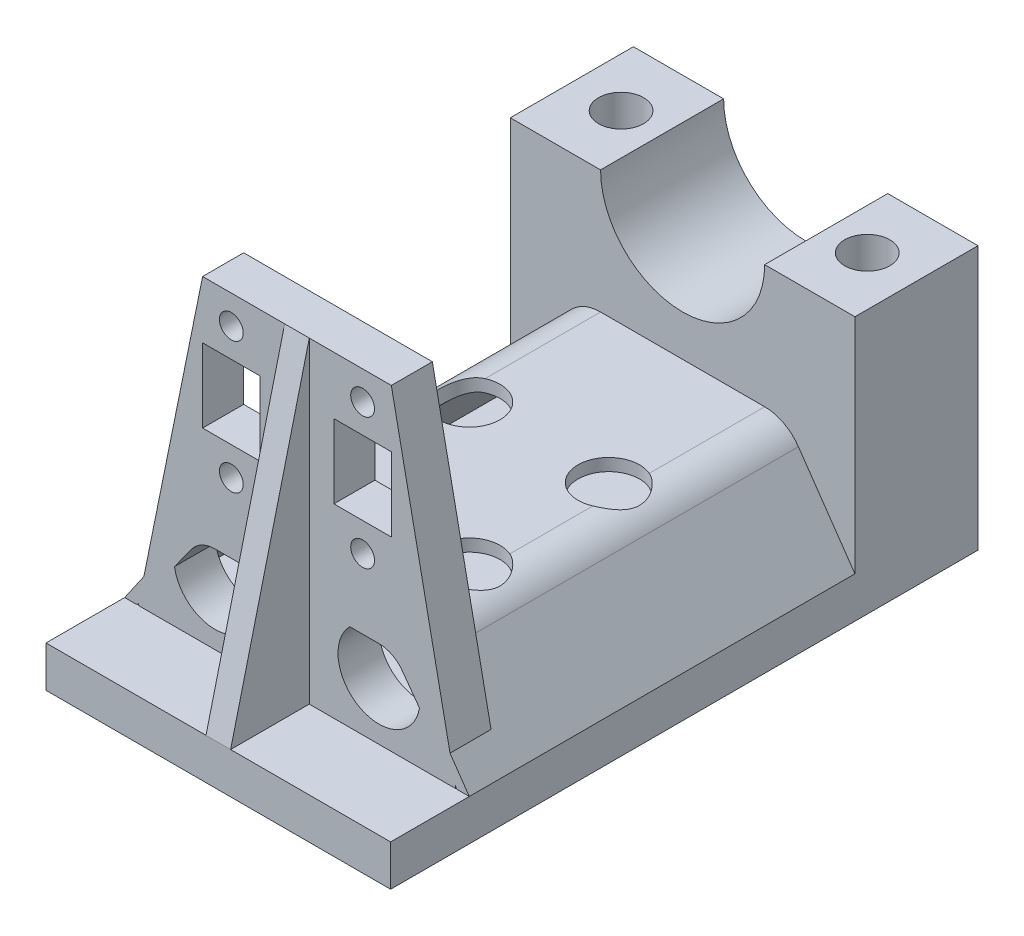
from build123d import *

# Parameters (mm, degrees)
MOTOR_MOUNT_SOLID_DEPTH                   = 7.5
ENCODER_DISTANCE_SKETCH_W                 = 50
ENCODER_DISTANCE_SKETCH_H                 = 57
ENCODER_DISTANCE_SOLID_DEPTH              = 5
ENCODER_MOUNT_SKETCH_R                    = 1.45
ENCODER_MOUNT_SKETCH_W                    = 7
ENCODER_MOUNT_SKETCH_H                    = 9
ENCODER_MOUNT_SOLID_DEPTH                 = 5
MOTOR_CLAMP_MOUNTING_HOLES_CUT_DEPTH      = 85.824819481
MOTOR_CLAMP_MOUNTING_HOLES_CUT_DEPTH_BACK = 85.824819481
MOTOR_CLAMP_MOUNTING_HOLES_SKETCH_R       = 2.75
GUSSET_PLATE_SKETCH_W                     = 50
GUSSET_PLATE_SKETCH_H                     = 5
GUSSET_PLATE_SOLID_DEPTH                  = 16.5
GUSSET_SOLID_DEPTH                        = 1.5
MOUNTING_PLATE_SKETCH_W                   = 50
MOUNTING_PLATE_SKETCH_H                   = 92
MOUNTING_PLATE_SKETCH_R                   = 2.65
MOUNTING_PLATE_SOLID_DEPTH                = 5
MOUNTING_HOLES_CUT_DEPTH                  = 101.440280764
MOUNTING_HOLES_CUT_DEPTH_BACK             = 101.440280764
MOUNTING_HOLE_SKETCH_R                    = 2.65
MOUNTING_PLATE_TRIM_SKETCH_W              = 50
MOUNTING_PLATE_TRIM_SKETCH_H              = 13.5
MOUNTING_PLATE_TRIM_SKETCH_H_2            = 42
MOUNTING_PLATE_TRIM_SKETCH_W_2            = 23.5
MOUNTING_PLATE_TRIM_SKETCH_H_3            = 16.5
MOUNTING_PLATE_TRIM_CUT_DEPTH             = 2
CUT_EXTRUDE1_DEPTH                        = 102.917859083
CUT_EXTRUDE1_DEPTH_BACK                   = 102.917859083
SKETCH2_W                                 = 50
SKETCH2_H                                 = 120
SKETCH2_W_2                               = 42
SKETCH2_H_2                               = 54.272597004
SKETCH3_W                                 = 42
SKETCH3_H                                 = 71.586450004
BOSS_EXTRUDE1_DEPTH                       = 5
CUT_EXTRUDE2_DEPTH                        = 78.722819275
CUT_EXTRUDE2_DEPTH_BACK                   = 78.722819275
SKETCH4_R                                 = 2.15
CUT_EXTRUDE3_DEPTH                        = 73.922847458
CUT_EXTRUDE3_DEPTH_BACK                   = 73.922847458
SKETCH5_R                                 = 5
BOSS_EXTRUDE4_REACH                       = 83.23
CUT_EXTRUDE5_REACH                        = 82.326
SKETCH7_R                                 = 3.75


with BuildPart() as part:
    # Mouting Mount Sketch → Motor Mount Solid (new, symmetric)
    with BuildSketch(Plane.XY):
        with BuildLine():
            Line((-25, -55), (25, -55))
            Line((25, -55), (25, 0))
            Line((25, 0), (10, 0))
            ThreePointArc((10, 0), (0, -10), (-10, 0))
            Line((-10, 0), (-25, 0))
            Line((-25, 0), (-25, -55))
        make_face()
    extrude(amount=MOTOR_MOUNT_SOLID_DEPTH, both=True)

    # Encoder Distance Sketch → Encoder Distance Solid (add)
    with BuildSketch(Plane.XZ.offset(55)):
        with Locations((0, 21)):
            Rectangle(ENCODER_DISTANCE_SKETCH_W, ENCODER_DISTANCE_SKETCH_H)
    extrude(amount=ENCODER_DISTANCE_SOLID_DEPTH)

    # Encoder Mount Sketch → Encoder Mount Solid (add)
    with BuildSketch(Plane.XY.offset(49.5)):
        Polygon((-25, -60), (-25, -55), (-11.5, 11.5), (11.5, 11.5), (25, -55), (25, -60), align=None)
        with Locations((-8, 8)):
            Circle(ENCODER_MOUNT_SKETCH_R, mode=Mode.SUBTRACT)
        with Locations((8, 8)):
            Circle(ENCODER_MOUNT_SKETCH_R, mode=Mode.SUBTRACT)
        with Locations((-8, -8)):
            Circle(ENCODER_MOUNT_SKETCH_R, mode=Mode.SUBTRACT)
        with Locations((8, -8)):
            Circle(ENCODER_MOUNT_SKETCH_R, mode=Mode.SUBTRACT)
        with Locations((-8, 0)):
            Rectangle(ENCODER_MOUNT_SKETCH_W, ENCODER_MOUNT_SKETCH_H, mode=Mode.SUBTRACT)
        with Locations((8, 0)):
            Rectangle(ENCODER_MOUNT_SKETCH_W, ENCODER_MOUNT_SKETCH_H, mode=Mode.SUBTRACT)
    extrude(amount=ENCODER_MOUNT_SOLID_DEPTH)

    # Motor Clamp Mounting Holes Sketch → Motor Clamp Mounting Holes Cut (cut, two sides: drawn at the far end of the back side and taken through both)
    with BuildSketch(Plane(origin=(0, 0, 0), x_dir=(1, 0, 0), z_dir=(0, 1, 0)).offset(-MOTOR_CLAMP_MOUNTING_HOLES_CUT_DEPTH_BACK)):
        with Locations(Location((-15, 0, 0), (0, 0, 180))):
            Circle(MOTOR_CLAMP_MOUNTING_HOLES_SKETCH_R)
        with Locations(Location((15, 0, 0), (0, 0, 180))):
            Circle(MOTOR_CLAMP_MOUNTING_HOLES_SKETCH_R)
    extrude(amount=MOTOR_CLAMP_MOUNTING_HOLES_CUT_DEPTH + MOTOR_CLAMP_MOUNTING_HOLES_CUT_DEPTH_BACK, mode=Mode.SUBTRACT)

    # Gusset Plate Sketch → Gusset Plate Solid (add)
    with BuildSketch(Plane.XY.offset(54.5)):
        with Locations((0, -57.5)):
            Rectangle(GUSSET_PLATE_SKETCH_W, GUSSET_PLATE_SKETCH_H)
    extrude(amount=GUSSET_PLATE_SOLID_DEPTH)

    # Gusset Sketch → Gusset Solid (add, symmetric)
    with BuildSketch(Plane(origin=(0, 0, 0), x_dir=(0, 0, -1), z_dir=(1, 0, 0))):
        Polygon((-54.5, 11.5), (-71, -55), (-54.5, -55), align=None)
    extrude(amount=GUSSET_SOLID_DEPTH, both=True)

    # Mounting Plate Sketch → Mounting Plate Solid (add)
    with BuildSketch(Plane(origin=(0, -55, 0), x_dir=(1, 0, 0), z_dir=(0, 1, 0))):
        with Locations((0, -25)):
            Rectangle(MOUNTING_PLATE_SKETCH_W, MOUNTING_PLATE_SKETCH_H)
        with Locations((-19, -65)):
            Circle(MOUNTING_PLATE_SKETCH_R, mode=Mode.SUBTRACT)
        with Locations((19, -65)):
            Circle(MOUNTING_PLATE_SKETCH_R, mode=Mode.SUBTRACT)
        with Locations(Location((-19, 15, 0), (0, 0, 270))):
            Circle(MOUNTING_PLATE_SKETCH_R, mode=Mode.SUBTRACT)
        with Locations(Location((19, 15, 0), (0, 0, 270))):
            Circle(MOUNTING_PLATE_SKETCH_R, mode=Mode.SUBTRACT)
    extrude(amount=-MOUNTING_PLATE_SOLID_DEPTH)

    # Mounting Hole Sketch → Mounting Holes Cut (cut, two sides: drawn at the far end of the back side and taken through both)
    with BuildSketch(Plane(origin=(0, -55, 0), x_dir=(1, 0, 0), z_dir=(0, 1, 0)).offset(-MOUNTING_HOLES_CUT_DEPTH_BACK)):
        with Locations(Location((-19, 15, 0), (0, 0, 270))):
            Circle(MOUNTING_HOLE_SKETCH_R)
        with Locations(Location((19, 15, 0), (0, 0, 270))):
            Circle(MOUNTING_HOLE_SKETCH_R)
        with Locations(Location((19, -65, 0), (0, 0, 90))):
            Circle(MOUNTING_HOLE_SKETCH_R)
        with Locations(Location((-19, -65, 0), (0, 0, 90))):
            Circle(MOUNTING_HOLE_SKETCH_R)
    extrude(amount=MOUNTING_HOLES_CUT_DEPTH + MOUNTING_HOLES_CUT_DEPTH_BACK, mode=Mode.SUBTRACT)

    # Mounting Plate Trim Sketch → Mounting Plate Trim Cut (cut)
    with BuildSketch(Plane(origin=(0, -55, 0), x_dir=(1, 0, 0), z_dir=(0, 1, 0))):
        with Locations((0, 14.25)):
            Rectangle(MOUNTING_PLATE_TRIM_SKETCH_W, MOUNTING_PLATE_TRIM_SKETCH_H)
        with Locations((0, -28.5)):
            Rectangle(MOUNTING_PLATE_TRIM_SKETCH_W, MOUNTING_PLATE_TRIM_SKETCH_H_2)
        with Locations((13.25, -62.75)):
            Rectangle(MOUNTING_PLATE_TRIM_SKETCH_W_2, MOUNTING_PLATE_TRIM_SKETCH_H_3)
        with Locations((-13.25, -62.75)):
            Rectangle(MOUNTING_PLATE_TRIM_SKETCH_W_2, MOUNTING_PLATE_TRIM_SKETCH_H_3)
    extrude(amount=-MOUNTING_PLATE_TRIM_CUT_DEPTH, mode=Mode.SUBTRACT)

    # Sketch2 → Cut-Extrude1 (cut, two sides: drawn at the far end of the back side and taken through both)
    with BuildSketch(Plane(origin=(0, 0, -7.5), x_dir=(-1, 0, 0), z_dir=(0, 0, -1)).offset(-CUT_EXTRUDE1_DEPTH_BACK)):
        Rectangle(SKETCH2_W, SKETCH2_H)
        Rectangle(SKETCH2_W_2, SKETCH2_H_2, mode=Mode.SUBTRACT)
    extrude(amount=CUT_EXTRUDE1_DEPTH + CUT_EXTRUDE1_DEPTH_BACK, mode=Mode.SUBTRACT)


with BuildPart() as cut_extrude1_piece_1:
    # of the separate pieces the step leaves, piece 1, a body of its own (cut_extrude1_pieces)
    add(part.part.solids().sort_by_distance((21, 0, 7.5))[0])



with BuildPart() as cut_extrude1_piece_2:
    # of the separate pieces the step leaves, piece 2, a body of its own (cut_extrude1_pieces)
    add(part.part.solids().sort_by_distance((-1.5, -27.136298502, 54.5))[0])


with BuildPart() as cut_extrude1_piece_1_1:
    add(cut_extrude1_piece_1.part)

    add(cut_extrude1_piece_2.part)  # Boss-Extrude1 merges Cut-Extrude1 piece 2
    # Sketch3 → Boss-Extrude1 (add)
    with BuildSketch(Plane.XZ.offset(27.136298502)):
        with Locations((0, 28.293225002)):
            Rectangle(SKETCH3_W, SKETCH3_H)
    extrude(amount=BOSS_EXTRUDE1_DEPTH)

    # Sketch4 → Cut-Extrude2 (cut, two sides: drawn at the far end of the back side and taken through both)
    with BuildSketch(Plane(origin=(0, -27.136298502, 0), x_dir=(1, 0, 0), z_dir=(0, 1, 0)).offset(-CUT_EXTRUDE2_DEPTH_BACK)):
        with Locations(Location((-8.5, -25, 0), (0, 0, 270))):
            Circle(SKETCH4_R)
        with Locations(Location((8.5, -25, 0), (0, 0, 270))):
            Circle(SKETCH4_R)
        with Locations(Location((-8.5, -42, 0), (0, 0, 270))):
            Circle(SKETCH4_R)
        with Locations(Location((8.5, -42, 0), (0, 0, 270))):
            Circle(SKETCH4_R)
    extrude(amount=CUT_EXTRUDE2_DEPTH + CUT_EXTRUDE2_DEPTH_BACK, mode=Mode.SUBTRACT)

    # Sketch5 → Cut-Extrude3 (cut, two sides: drawn at the far end of the back side and taken through both)
    with BuildSketch(Plane.XY.offset(54.5).offset(-CUT_EXTRUDE3_DEPTH_BACK)):
        with Locations((-10, -20)):
            Circle(SKETCH5_R)
        with Locations((10, -20)):
            Circle(SKETCH5_R)
    extrude(amount=CUT_EXTRUDE3_DEPTH + CUT_EXTRUDE3_DEPTH_BACK, mode=Mode.SUBTRACT)

    # Boss-Extrude4: up to this face of the body (flat: up to its plane)
    boss_extrude4_end = Plane(cut_extrude1_piece_1_1.part.faces().sort_by_distance((8.495517831, -9.422722632, 54.5))[0])
    # Sketch6 → Boss-Extrude4 (add, up to the picked face)
    with BuildSketch(Plane(origin=(0, 0, -7.5), x_dir=(-1, 0, 0), z_dir=(0, 0, -1)), mode=Mode.PRIVATE) as boss_extrude4_sk1:
        with BuildLine():
            Line((21, -27.136298502), (19.5, -27.136298502))
            Line((19.5, -27.136298502), (12.880616906, -18.012024587))
            ThreePointArc((12.880616906, -18.012024587), (11.626666231, -16.900974835), (10, -16.5))
            Line((10, -16.5), (-10, -16.5))
            ThreePointArc((-10, -16.5), (-11.626666231, -16.900974835), (-12.880616906, -18.012024587))
            Line((-12.880616906, -18.012024587), (-19.5, -27.136298502))
            Line((-19.5, -27.136298502), (-21, -27.136298502))
            Line((-21, -27.136298502), (-14.115167008, -17.160035124))
            ThreePointArc((-14.115167008, -17.160035124), (-12.323808901, -15.572821193), (-10, -15))
            Line((-10, -15), (10, -15))
            ThreePointArc((10, -15), (12.323808901, -15.572821193), (14.115167008, -17.160035124))
            Line((14.115167008, -17.160035124), (21, -27.136298502))
        make_face()
    boss_extrude4_tool1 = split(extrude(boss_extrude4_sk1.sketch, amount=-BOSS_EXTRUDE4_REACH, mode=Mode.PRIVATE), bisect_by=boss_extrude4_end, keep=Keep.BOTH, mode=Mode.PRIVATE)
    add(boss_extrude4_tool1.solids().sort_by(Axis((-20.25, -26.699116, -7.5), (0, 0, 1)))[0])

    # Cut-Extrude5: up to this face of the body (flat: up to its plane)
    cut_extrude5_end = Plane(cut_extrude1_piece_1_1.part.faces().sort_by_distance((0, -15, 28.5))[0])
    # Sketch7 → Cut-Extrude5 (cut, up to the picked face)
    with BuildSketch(Plane.XZ.offset(32.136298502), mode=Mode.PRIVATE) as cut_extrude5_sk1:
        with Locations(Location((-8.5, 42, 0), (0, 0, 246.421821522))):
            Circle(SKETCH7_R)
    cut_extrude5_tool1 = split(extrude(cut_extrude5_sk1.sketch, amount=-CUT_EXTRUDE5_REACH, mode=Mode.PRIVATE), bisect_by=cut_extrude5_end, keep=Keep.BOTH, mode=Mode.PRIVATE)
    # Sketch7 → Cut-Extrude5 (cut, up to the picked face)
    with BuildSketch(Plane.XZ.offset(32.136298502), mode=Mode.PRIVATE) as cut_extrude5_sk2:
        with Locations(Location((8.5, 42, 0), (0, 0, 293.578178478))):
            Circle(SKETCH7_R)
    cut_extrude5_tool2 = split(extrude(cut_extrude5_sk2.sketch, amount=-CUT_EXTRUDE5_REACH, mode=Mode.PRIVATE), bisect_by=cut_extrude5_end, keep=Keep.BOTH, mode=Mode.PRIVATE)
    # Sketch7 → Cut-Extrude5 (cut, up to the picked face)
    with BuildSketch(Plane.XZ.offset(32.136298502), mode=Mode.PRIVATE) as cut_extrude5_sk3:
        with Locations(Location((8.5, 25, 0), (0, 0, 293.578178478))):
            Circle(SKETCH7_R)
    cut_extrude5_tool3 = split(extrude(cut_extrude5_sk3.sketch, amount=-CUT_EXTRUDE5_REACH, mode=Mode.PRIVATE), bisect_by=cut_extrude5_end, keep=Keep.BOTH, mode=Mode.PRIVATE)
    # Sketch7 → Cut-Extrude5 (cut, up to the picked face)
    with BuildSketch(Plane.XZ.offset(32.136298502), mode=Mode.PRIVATE) as cut_extrude5_sk4:
        with Locations(Location((-8.5, 25, 0), (0, 0, 246.421821522))):
            Circle(SKETCH7_R)
    cut_extrude5_tool4 = split(extrude(cut_extrude5_sk4.sketch, amount=-CUT_EXTRUDE5_REACH, mode=Mode.PRIVATE), bisect_by=cut_extrude5_end, keep=Keep.BOTH, mode=Mode.PRIVATE)
    add(cut_extrude5_tool1.solids().sort_by(Axis((-8.5, -32.136299, 42), (0, 1, 0)))[0], mode=Mode.SUBTRACT)
    add(cut_extrude5_tool2.solids().sort_by(Axis((8.5, -32.136299, 42), (0, 1, 0)))[0], mode=Mode.SUBTRACT)
    add(cut_extrude5_tool3.solids().sort_by(Axis((8.5, -32.136299, 25), (0, 1, 0)))[0], mode=Mode.SUBTRACT)
    add(cut_extrude5_tool4.solids().sort_by(Axis((-8.5, -32.136299, 25), (0, 1, 0)))[0], mode=Mode.SUBTRACT)


solid = cut_extrude1_piece_1_1.part
